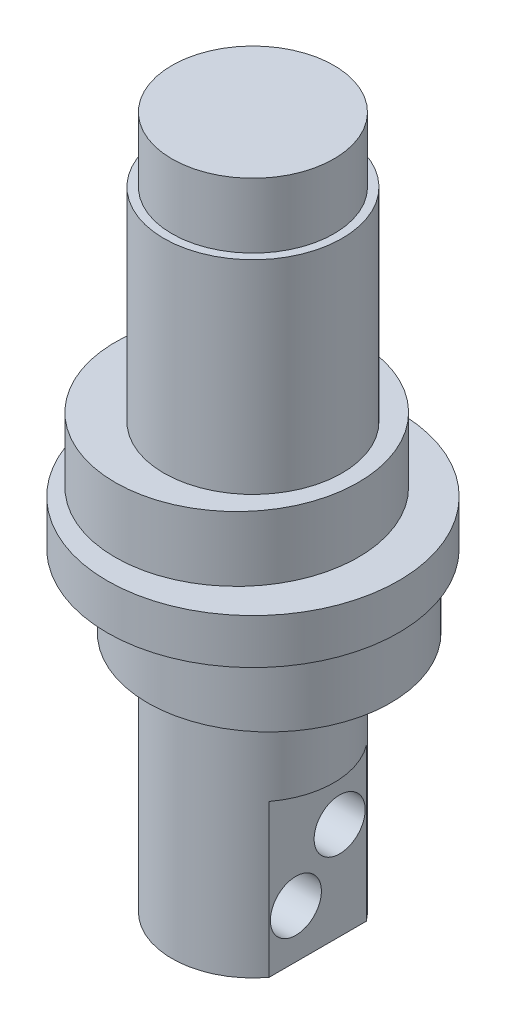
from build123d import *
from build123d.topology import SkipClean

# Parameters (mm, degrees)
SKETCH1_R               = 7.5
BOSS_EXTRUDE1_DEPTH     = 6.779166667
SKETCH1_3_R             = 7.5
BOSS_EXTRUDE2_DEPTH     = 2.779166667
BOSS_EXTRUDE3_START     = -4
SKETCH1_4_R             = 7.5
BOSS_EXTRUDE3_DEPTH     = 4
SKETCH2_R               = 5
BOSS_EXTRUDE4_DEPTH     = 6.016666667
SKETCH2_3_R             = 5.5
SKETCH2_3_R_2           = 5
BOSS_EXTRUDE5_DEPTH     = 1.254166667
BOSS_EXTRUDE9_START     = 16.541666667
SKETCH3_R               = 5
BOSS_EXTRUDE9_DEPTH     = 16.541666667
BOSS_EXTRUDE10_START    = 12.541666667
SKETCH3_3_R             = 5.5
SKETCH3_3_R_2           = 5
BOSS_EXTRUDE10_DEPTH    = 12.541666667
BOSS_EXTRUDE11_DEPTH    = 9.4
CUT_EXTRUDE1_DEPTH      = 28.502022969
CUT_EXTRUDE1_DEPTH_BACK = 28.502022969
SKETCH5_R               = 1.575
CUT_EXTRUDE5_START      = -2.779166667
CUT_EXTRUDE5_DEPTH      = 2.779166667
BOSS_EXTRUDE12_START    = -2.779166667
SKETCH6_4_R             = 9
BOSS_EXTRUDE12_DEPTH    = 2.779166667


with BuildPart() as part:
    # Sketch1 → Boss-Extrude1 (new body)
    with BuildSketch(Plane(origin=(0, 0, 0), x_dir=(1, 0, 0), z_dir=(0, 1, 0))):
        with Locations(Location((-1, 0, 0), (0, 0, 270))):
            Circle(SKETCH1_R)
    extrude(amount=BOSS_EXTRUDE1_DEPTH)

    # Sketch1<3> → Boss-Extrude2 (add)
    with BuildSketch(Plane(origin=(0, 0, 0), x_dir=(1, 0, 0), z_dir=(0, 1, 0))):
        with Locations(Location((-1, 0, 0), (0, 0, 82.337744339))):
            Circle(SKETCH1_3_R)
        with Locations((1, 0)):
            Circle(SKETCH1_3_R)
    extrude(amount=BOSS_EXTRUDE2_DEPTH)

    # Sketch1<4> → Boss-Extrude3 (add)
    with BuildSketch(Plane(origin=(0, 0, 0), x_dir=(1, 0, 0), z_dir=(0, 1, 0)).offset(BOSS_EXTRUDE3_START)):
        with Locations(Location((1, 0, 0), (0, 0, 97.662255661))):
            Circle(SKETCH1_4_R)
        with BuildLine():
            Line((-1.54175225, 2.127), (1.54175225, 2.127))
            ThreePointArc((1.54175225, 2.127), (0, -2.627), (-1.54175225, 2.127))
        make_face(mode=Mode.SUBTRACT)
    extrude(amount=BOSS_EXTRUDE3_DEPTH)

    # Sketch2 → Boss-Extrude4 (add)
    with BuildSketch(Plane.XZ.offset(4)):
        with Locations(Location((0, 0, 0), (0, 0, 90))):
            Circle(SKETCH2_R)
    extrude(amount=BOSS_EXTRUDE4_DEPTH)

    # Sketch2<3> → Boss-Extrude5 (add)
    with BuildSketch(Plane.XZ.offset(4)):
        with Locations(Location((0, 0, 0), (0, 0, 90))):
            Circle(SKETCH2_3_R)
        with Locations(Location((0, 0, 0), (0, 0, 270))):
            Circle(SKETCH2_3_R_2, mode=Mode.SUBTRACT)
    extrude(amount=BOSS_EXTRUDE5_DEPTH)

    # Sketch3 → Boss-Extrude9 (add)
    with BuildSketch(Plane(origin=(0, 6.779166667, 0), x_dir=(1, 0, 0), z_dir=(0, 1, 0)).offset(BOSS_EXTRUDE9_START)):
        with Locations(Location((0, 0, 0), (0, 0, 90))):
            Circle(SKETCH3_R)
    extrude(amount=-BOSS_EXTRUDE9_DEPTH)

    # Sketch3<3> → Boss-Extrude10 (add)
    with BuildSketch(Plane(origin=(0, 6.779166667, 0), x_dir=(1, 0, 0), z_dir=(0, 1, 0)).offset(BOSS_EXTRUDE10_START)):
        with Locations(Location((0, 0, 0), (0, 0, 270))):
            Circle(SKETCH3_3_R)
        with Locations(Location((0, 0, 0), (0, 0, 90))):
            Circle(SKETCH3_3_R_2, mode=Mode.SUBTRACT)
    extrude(amount=-BOSS_EXTRUDE10_DEPTH)

    # Sketch4 → Boss-Extrude11 (add)
    with BuildSketch(Plane.XZ.offset(10.016666667)):
        with BuildLine():
            Line((-4, 3), (-4, -3))
            ThreePointArc((-4, -3), (0, -5), (4, -3))
            Line((4, -3), (4, 3))
            ThreePointArc((4, 3), (0, 5), (-4, 3))
        make_face()
    extrude(amount=BOSS_EXTRUDE11_DEPTH)

    # Sketch5 → Cut-Extrude1 (cut, two sides: drawn at the far end of the back side and taken through both)
    with BuildSketch(Plane(origin=(4, 0, 0), x_dir=(0, 0, -1), z_dir=(1, 0, 0)).offset(-CUT_EXTRUDE1_DEPTH_BACK)):
        with Locations(Location((-1.35, -16.416666667, 0), (0, 0, 180))):
            Circle(SKETCH5_R)
        with Locations(Location((1.35, -13.416666667, 0), (0, 0, 180))):
            Circle(SKETCH5_R)
    extrude(amount=CUT_EXTRUDE1_DEPTH + CUT_EXTRUDE1_DEPTH_BACK, mode=Mode.SUBTRACT)

    # Sketch6 → Cut-Extrude5 (cut)
    with SkipClean():  # the faces are left unmerged after this step: merging them gives an invalid solid
        with BuildSketch(Plane(origin=(0, 2.779166667, 0), x_dir=(1, 0, 0), z_dir=(0, 1, 0)).offset(CUT_EXTRUDE5_START)):
            with BuildLine():
                ThreePointArc((0, -7.433034374), (8.5, 0), (0, 7.433034374))
                ThreePointArc((0, 7.433034374), (6.5, 0), (0, -7.433034374))
            make_face()
        extrude(amount=CUT_EXTRUDE5_DEPTH, mode=Mode.SUBTRACT)

    # Sketch6<4> → Boss-Extrude12 (add)
    # profile 1 of 2: a face of its own
    with BuildSketch(Plane(origin=(0, 2.779166667, 0), x_dir=(1, 0, 0), z_dir=(0, 1, 0)).offset(BOSS_EXTRUDE12_START)):
        with Locations(Location((0, 0, 0), (0, 0, 270))):
            Circle(SKETCH6_4_R)
        with BuildLine():
            ThreePointArc((0, 7.433034374), (6.5, 0), (0, -7.433034374))
            ThreePointArc((0, -7.433034374), (8.5, 0), (0, 7.433034374))
        make_face(mode=Mode.SUBTRACT)
    # profile 2 of 2: a face of its own
    with BuildSketch(Plane(origin=(0, 2.779166667, 0), x_dir=(1, 0, 0), z_dir=(0, 1, 0)).offset(BOSS_EXTRUDE12_START)):
        with BuildLine():
            ThreePointArc((0, -7.433034374), (8.5, 0), (0, 7.433034374))
            ThreePointArc((0, 7.433034374), (6.5, 0), (0, -7.433034374))
        make_face()
    extrude(amount=BOSS_EXTRUDE12_DEPTH)


solid = part.part
